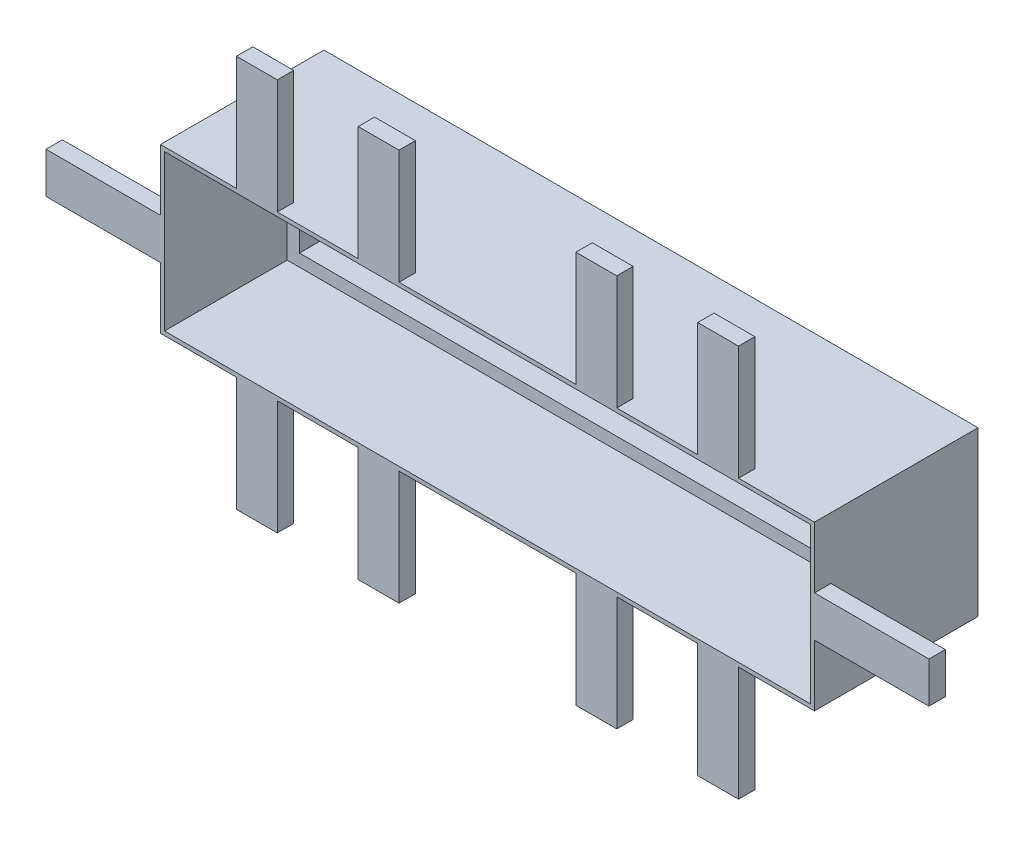
from build123d import *

# Parameters (mm, degrees)
ESQUISSE1_W        = 400
ESQUISSE1_H        = 100
ESQUISSE1_W_2      = 395
ESQUISSE1_H_2      = 95
BOSS_EXTRU_2_DEPTH = 100
ESQUISSE3_W        = 400
ESQUISSE3_H        = 100
ESQUISSE3_W_2      = 380
ESQUISSE3_H_2      = 80
BOSS_EXTRU_3_DEPTH = 25
BOSS_EXTRU_4_START = 100
ESQUISSE4_W        = 70
ESQUISSE4_H        = 25
ESQUISSE4_W_2      = 25
ESQUISSE4_H_2      = 70
BOSS_EXTRU_4_DEPTH = 10


with BuildPart() as part:
    # Esquisse1 → Boss.-Extru.2 (new body)
    with BuildSketch(Plane.XY):
        Rectangle(ESQUISSE1_W, ESQUISSE1_H)
        Rectangle(ESQUISSE1_W_2, ESQUISSE1_H_2, mode=Mode.SUBTRACT)
    extrude(amount=BOSS_EXTRU_2_DEPTH)

    # Esquisse3 → Boss.-Extru.3 (add)
    with BuildSketch(Plane.XY):
        Rectangle(ESQUISSE3_W, ESQUISSE3_H)
        Rectangle(ESQUISSE3_W_2, ESQUISSE3_H_2, mode=Mode.SUBTRACT)
    extrude(amount=BOSS_EXTRU_3_DEPTH)

    # Esquisse4 → Boss.-Extru.4 (add)
    with BuildSketch(Plane.XY.offset(BOSS_EXTRU_4_START)):
        with Locations((-235, 0)):
            Rectangle(ESQUISSE4_W, ESQUISSE4_H)
        with Locations((235, 0)):
            Rectangle(ESQUISSE4_W, ESQUISSE4_H)
        with Locations((-141.037105637, 85)):
            Rectangle(ESQUISSE4_W_2, ESQUISSE4_H_2)
        with Locations((141.037105637, 85)):
            Rectangle(ESQUISSE4_W_2, ESQUISSE4_H_2)
        with Locations((-66.58352445, 85)):
            Rectangle(ESQUISSE4_W_2, ESQUISSE4_H_2)
        with Locations((66.58352445, 85)):
            Rectangle(ESQUISSE4_W_2, ESQUISSE4_H_2)
        with Locations((141.037105637, -85)):
            Rectangle(ESQUISSE4_W_2, ESQUISSE4_H_2)
        with Locations((66.58352445, -85)):
            Rectangle(ESQUISSE4_W_2, ESQUISSE4_H_2)
        with Locations((-66.58352445, -85)):
            Rectangle(ESQUISSE4_W_2, ESQUISSE4_H_2)
        with Locations((-141.037105637, -85)):
            Rectangle(ESQUISSE4_W_2, ESQUISSE4_H_2)
    extrude(amount=-BOSS_EXTRU_4_DEPTH)


solid = part.part
